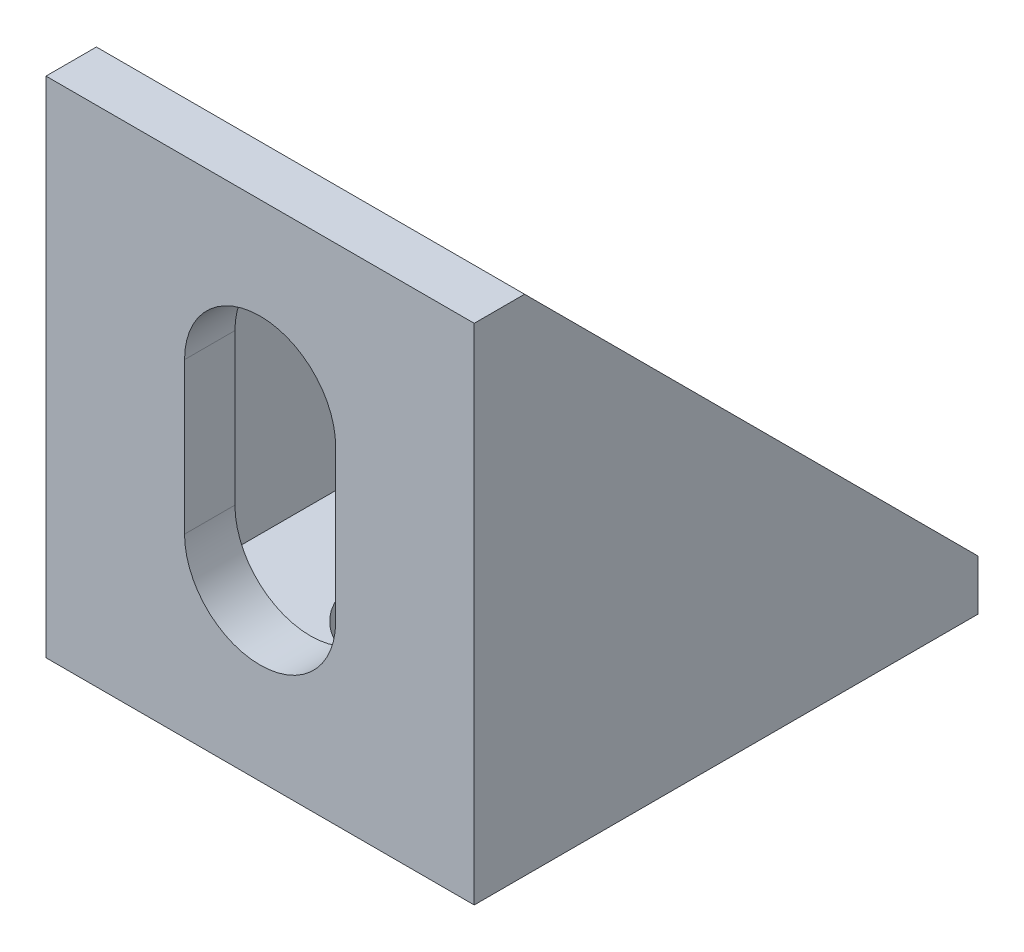
from build123d import *

# Parameters (mm, degrees)
BOSS_EXTRUDE1_DEPTH = 17
SKETCH2_W           = 13
SKETCH2_H           = 18
CUT_EXTRUDE1_DEPTH  = 18
CUT_EXTRUDE2_REACH  = 33.828
CUT_EXTRUDE3_REACH  = 33.828


with BuildPart() as part:
    # Sketch1 → Boss-Extrude1 (new body)
    with BuildSketch(Plane(origin=(0, 0, 0), x_dir=(0, 0, -1), z_dir=(1, 0, 0))):
        Polygon((0, 0), (0, 20), (2, 20), (20, 2), (20, 0), align=None)
    extrude(amount=BOSS_EXTRUDE1_DEPTH)

    # Sketch2 → Cut-Extrude1 (cut)
    with BuildSketch(Plane(origin=(0, 20, 0), x_dir=(1, 0, 0), z_dir=(0, 1, 0))):
        with Locations((8.5, 11)):
            Rectangle(SKETCH2_W, SKETCH2_H)
    extrude(amount=-CUT_EXTRUDE1_DEPTH, mode=Mode.SUBTRACT)

    # Sketch3 → Cut-Extrude2 (cut, up to next)
    with BuildSketch(Plane(origin=(0, 0, -2), x_dir=(-1, 0, 0), z_dir=(0, 0, -1)), mode=Mode.PRIVATE) as cut_extrude2_sk1:
        with BuildLine():
            Line((-11.5, 7), (-11.5, 13))
            ThreePointArc((-11.5, 13), (-8.5, 16), (-5.5, 13))
            Line((-5.5, 13), (-5.5, 7))
            ThreePointArc((-5.5, 7), (-8.5, 4), (-11.5, 7))
        make_face()
    cut_extrude2_tool1 = extrude(cut_extrude2_sk1.sketch, amount=-CUT_EXTRUDE2_REACH, mode=Mode.PRIVATE) & part.part
    add(cut_extrude2_tool1.solids().sort_by_distance((8.5, 10, -2))[0], mode=Mode.SUBTRACT)

    # Sketch4 → Cut-Extrude3 (cut, up to next)
    with BuildSketch(Plane(origin=(0, 2, 0), x_dir=(1, 0, 0), z_dir=(0, 1, 0)), mode=Mode.PRIVATE) as cut_extrude3_sk1:
        with BuildLine():
            Line((11.5, 13), (11.5, 7))
            ThreePointArc((11.5, 7), (8.5, 4), (5.5, 7))
            Line((5.5, 7), (5.5, 13))
            ThreePointArc((5.5, 13), (8.5, 16), (11.5, 13))
        make_face()
    cut_extrude3_tool1 = extrude(cut_extrude3_sk1.sketch, amount=-CUT_EXTRUDE3_REACH, mode=Mode.PRIVATE) & part.part
    add(cut_extrude3_tool1.solids().sort_by_distance((8.5, 2, -10))[0], mode=Mode.SUBTRACT)


solid = part.part
